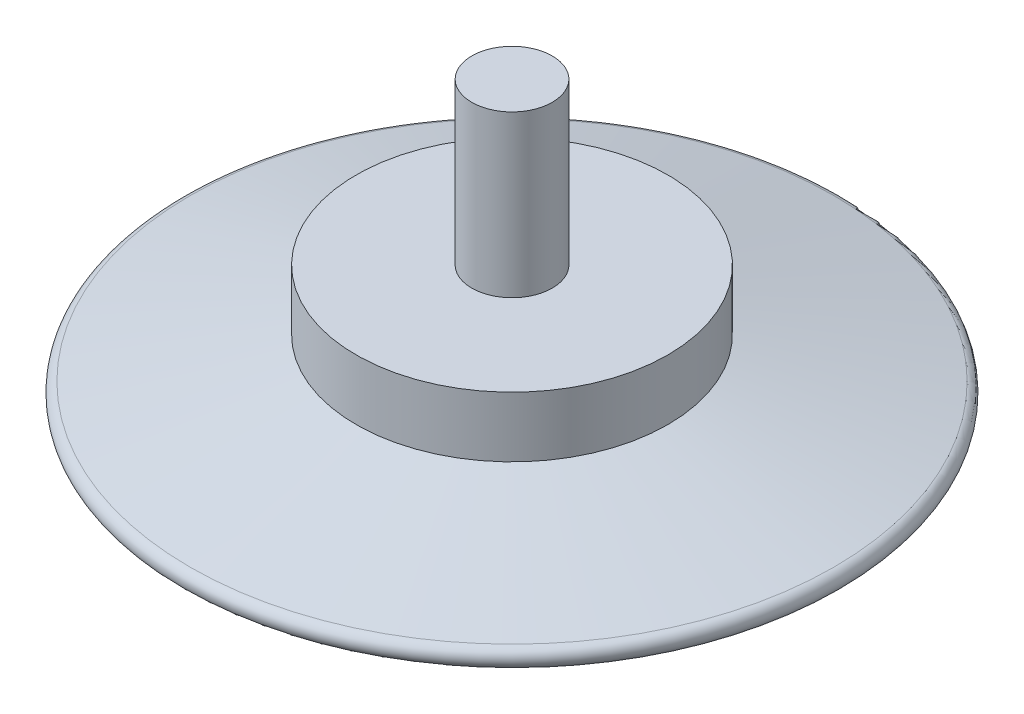
from build123d import *


with BuildPart() as part:
    # 草图1 → 旋转1 (revolve)
    with BuildSketch(Plane.XY, mode=Mode.PRIVATE) as revolve_1_sk:
        with BuildLine():
            Line((0, 14), (-2, 14))
            Line((-2, 14), (-2, 6))
            Line((-2, 6), (-7.75, 6))
            Line((-7.75, 6), (-7.75, 3))
            Line((-7.75, 3), (-16, 0.985732061))
            ThreePointArc((-16, 0.985732061), (-16.377826925, 0.440275761), (-15.881406725, 0))
            Line((-15.881406725, 0), (0, 0))
            Line((0, 0), (0, 14))
        make_face()
    revolve(revolve_1_sk.sketch.rotate(Axis((0, 0, 0), (0, 1, 0)), 180), axis=Axis((0, 0, 0), (0, 1, 0)))


solid = part.part
